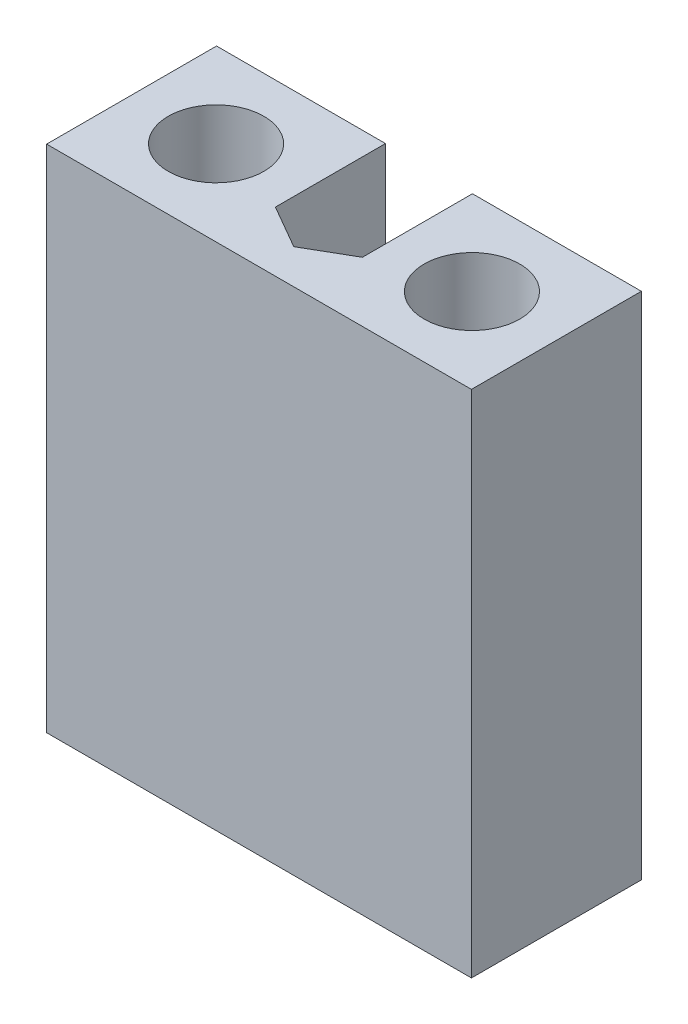
from build123d import *

# Parameters (mm, degrees)
BOSS_EXTRUDE1_DEPTH                                  = 76.2
CBORE_FOR_1_4_BINDING_HEAD_MACHINE_SCREW_D           = 6.7564
CBORE_FOR_1_4_BINDING_HEAD_MACHINE_SCREW_CBORE_D     = 14.2875
CBORE_FOR_1_4_BINDING_HEAD_MACHINE_SCREW_CBORE_DEPTH = 54.991


with BuildPart() as part:
    # Sketch1 → Boss-Extrude1 (new body)
    with BuildSketch(Plane(origin=(0, 0, 0), x_dir=(1, 0, 0), z_dir=(0, 1, 0))):
        Polygon((0, -7.505553499), (6.5, -3.75277675), (6.5, 3.75277675), (6.5, 12.7), (31.75, 12.7), (31.75, -12.7), (-31.75, -12.7), (-31.75, 12.7), (-6.5, 12.7), (-6.5, 3.75277675), (-6.5, -3.75277675), align=None)
    extrude(amount=BOSS_EXTRUDE1_DEPTH)

    # CBORE for 1/4 Binding Head Machine Screw1 (through all)
    with Locations(Plane(origin=(0, 76.2, 0), x_dir=(1, 0, 0), z_dir=(0, 1, 0))):
        with Locations((-19.125, 0), (19.125, 0)):
            CounterBoreHole(CBORE_FOR_1_4_BINDING_HEAD_MACHINE_SCREW_D / 2, CBORE_FOR_1_4_BINDING_HEAD_MACHINE_SCREW_CBORE_D / 2, CBORE_FOR_1_4_BINDING_HEAD_MACHINE_SCREW_CBORE_DEPTH)


solid = part.part
